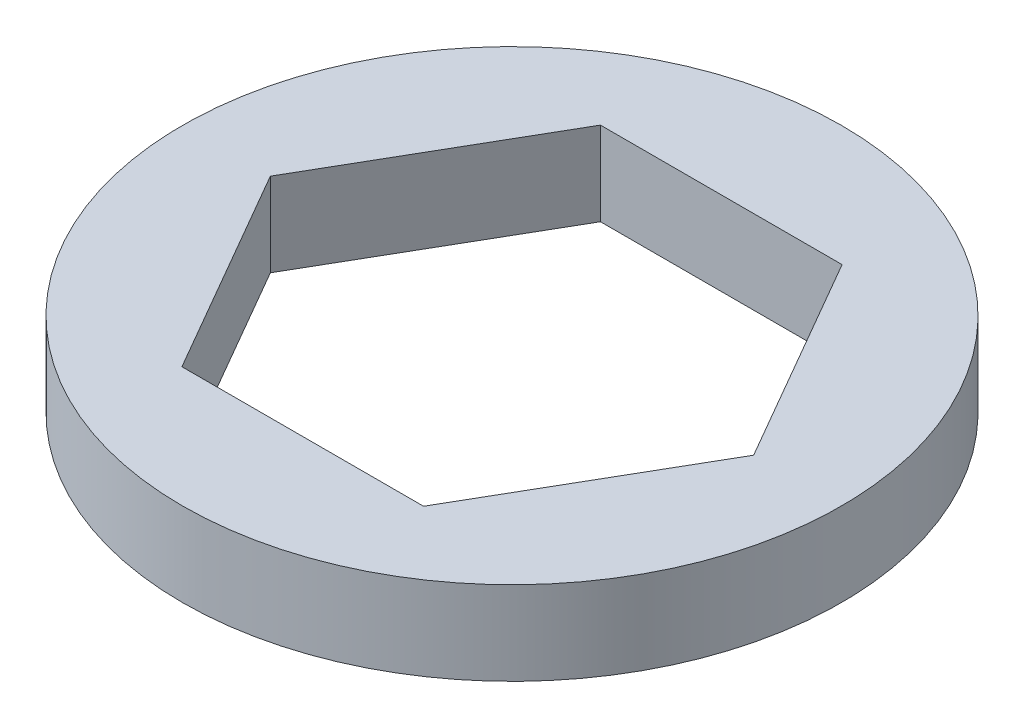
from build123d import *

# Parameters (mm, degrees)
SKETCH1_R           = 10
BOSS_EXTRUDE1_DEPTH = 2.54


with BuildPart() as part:
    # Sketch1 → Boss-Extrude1 (new body)
    with BuildSketch(Plane(origin=(0, 0, 0), x_dir=(1, 0, 0), z_dir=(0, 1, 0))):
        with Locations(Location((0, 0, 0), (0, 0, 270))):
            Circle(SKETCH1_R)
        Polygon((-7.332348419, 0), (-3.666174209, -6.35), (3.666174209, -6.35), (7.332348419, 0), (3.666174209, 6.35), (-3.666174209, 6.35), align=None, mode=Mode.SUBTRACT)
    extrude(amount=BOSS_EXTRUDE1_DEPTH)


solid = part.part
